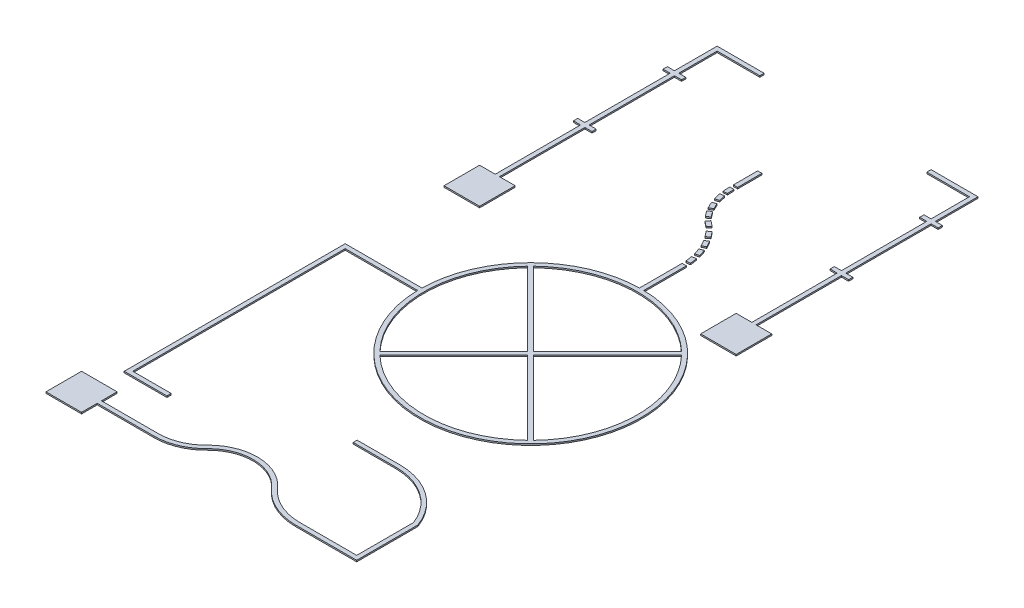
from build123d import *

# Parameters (mm, degrees)
SKETCH1_W           = 2438.4
SKETCH1_H           = 4876.8
BOSS_EXTRUDE1_DEPTH = 100
SKETCH2_W           = 2438.4
SKETCH2_H           = 4876.8
SKETCH2_W_2         = 29.994
SKETCH2_H_2         = 170.927857272
CUT_EXTRUDE1_DEPTH  = 100
CUT_EXTRUDE2_DEPTH  = 90
CUT_EXTRUDE3_DEPTH  = 90
CUT_EXTRUDE4_DEPTH  = 90
CUT_EXTRUDE5_DEPTH  = 90
CUT_EXTRUDE6_DEPTH  = 90
SKETCH8_W           = 29.994
SKETCH8_H           = 170.927857272
CUT_EXTRUDE7_DEPTH  = 90


with BuildPart() as part:
    # Sketch1 → Boss-Extrude1 (new body)
    with BuildSketch(Plane(origin=(0, 0, 0), x_dir=(1, 0, 0), z_dir=(0, 1, 0))):
        Rectangle(SKETCH1_W, SKETCH1_H)
    extrude(amount=BOSS_EXTRUDE1_DEPTH)

    # Sketch2 → Cut-Extrude1 (cut)
    # profile 1 of 5: a face of its own
    with BuildSketch(Plane(origin=(0, 100, 0), x_dir=(1, 0, 0), z_dir=(0, 1, 0))):
        Rectangle(SKETCH2_W, SKETCH2_H)
        with BuildLine():
            Line((-919.2, -2228.4), (-919.2, -2338.4))
            Line((-919.2, -2338.4), (-1169.2, -2338.4))
            Line((-1169.2, -2338.4), (-1169.2, -2088.4))
            Line((-1169.2, -2088.4), (-919.2, -2088.4))
            Line((-919.2, -2088.4), (-919.2, -2198.4))
            Line((-919.2, -2198.4), (-519.2, -2198.4))
            ThreePointArc((-519.2, -2198.4), (-388.263085664, -2171.917017743), (-277.909673512, -2096.631240126))
            ThreePointArc((-277.909673512, -2096.631240126), (-19.994263519, -1992.142953693), (231.567262992, -2111.117569023))
            ThreePointArc((231.567262992, -2111.117569023), (360.930329193, -2207.702777647), (518.697268509, -2241.953299987))
            Line((518.697268509, -2241.953299987), (918.697268509, -2241.953299987))
            Line((918.697268509, -2241.953299987), (918.697268509, -1841.953299987))
            ThreePointArc((918.697268509, -1841.953299987), (761.332604312, -1642.506806454), (518.697268509, -1567.203186754))
            Line((518.697268509, -1567.203186754), (218.697268509, -1567.203186754))
            Line((218.697268509, -1567.203186754), (218.697268509, -1539.074772669))
            Line((218.697268509, -1539.074772669), (518.697268509, -1539.074772669))
            ThreePointArc((518.697268509, -1539.074772669), (781.677972321, -1622.395299678), (948.697268509, -1841.953299987))
            Line((948.697268509, -1841.953299987), (948.697268509, -2271.953299987))
            Line((948.697268509, -2271.953299987), (518.697268509, -2271.953299987))
            ThreePointArc((518.697268509, -2271.953299987), (348.490866445, -2235.002223915), (208.9279, -2130.801553459))
            ThreePointArc((208.9279, -2130.801553459), (-20.846930763, -2022.130833888), (-256.425361631, -2117.569825155))
            ThreePointArc((-256.425361631, -2117.569825155), (-376.604559833, -2199.558992626), (-519.2, -2228.4))
            Line((-519.2, -2228.4), (-919.2, -2228.4))
        make_face(mode=Mode.SUBTRACT)
        with BuildLine():
            Line((-719.2, -1938.4), (-1019.2, -1938.4))
            Line((-1019.2, -1938.4), (-1019.2, -385))
            Line((-1019.2, -385), (-479.855755893, -385))
            ThreePointArc((-479.855755893, -385), (-251.543289326, 151.543289326), (285, 379.855755893))
            Line((285, 379.855755893), (285, 679.855755893))
            Line((285, 679.855755893), (315, 679.855755893))
            Line((315, 679.855755893), (315, 379.855755893))
            ThreePointArc((315, 379.855755893), (851.543289326, -951.543289326), (-479.855755893, -415))
            Line((-479.855755893, -415), (-989.2, -415))
            Line((-989.2, -415), (-989.2, -1908.4))
            Line((-989.2, -1908.4), (-719.2, -1908.4))
            Line((-719.2, -1908.4), (-719.2, -1938.4))
        make_face(mode=Mode.SUBTRACT)
        Polygon((-584.703, 2125.4), (-584.703, 2095.4), (-884.703, 2095.4), (-884.703, 1825.4), (-834.703, 1825.4), (-834.703, 1795.4), (-884.703, 1795.4), (-884.703, 1195.4), (-834.703, 1195.4), (-834.703, 1165.4), (-884.703, 1165.4), (-884.703, 565.4), (-774.703, 565.4), (-774.703, 315.4), (-1024.703, 315.4), (-1024.703, 565.4), (-914.703, 565.4), (-914.703, 1165.4), (-964.703, 1165.4), (-964.703, 1195.4), (-914.703, 1195.4), (-914.703, 1795.4), (-964.703, 1795.4), (-964.703, 1825.4), (-914.703, 1825.4), (-914.703, 2125.4), align=None, mode=Mode.SUBTRACT)
        with BuildLine():
            Line((313.363780337, 709.855755893), (283.48537458, 707.243266979))
            ThreePointArc((283.48537458, 707.243266979), (280.817354071, 730.454233152), (276.889903298, 753.485568645))
            Line((276.889903298, 753.485568645), (306.307291752, 759.330351401))
            ThreePointArc((306.307291752, 759.330351401), (310.509267678, 734.689146996), (313.363780337, 709.855755893))
        make_face(mode=Mode.SUBTRACT)
        with BuildLine():
            Line((299.292720231, 789.330351401), (270.333610539, 781.525596779))
            ThreePointArc((270.333610539, 781.525596779), (263.641859342, 803.91058617), (255.741601187, 825.898155504))
            Line((255.741601187, 825.898155504), (283.680743009, 836.804510677))
            ThreePointArc((283.680743009, 836.804510677), (292.133221855, 813.280030714), (299.292720231, 789.330351401))
        make_face(mode=Mode.SUBTRACT)
        with BuildLine():
            Line((270.72127371, 866.804510677), (243.628805062, 853.938183638))
            ThreePointArc((243.628805062, 853.938183638), (233.035185878, 874.762268653), (221.323804893, 894.978866774))
            Line((221.323804893, 894.978866774), (246.857174792, 910.713899361))
            ThreePointArc((246.857174792, 910.713899361), (259.387170406, 889.084179851), (270.72127371, 866.804510677))
        make_face(mode=Mode.SUBTRACT)
        with BuildLine():
            Line((165.011981963, 1009.40005714), (144.825754574, 987.217621459))
            ThreePointArc((144.825754574, 987.217621459), (127.124133149, 1002.466224119), (108.618763636, 1016.728712798))
            Line((108.618763636, 1016.728712798), (126.274156062, 1040.973946293))
            ThreePointArc((126.274156062, 1040.973946293), (146.073033678, 1025.714522931), (165.011981963, 1009.40005714))
        make_face(mode=Mode.SUBTRACT)
        with BuildLine():
            ThreePointArc((44.532414655, 1166.506238397), (53.763601741, 1145.241777983), (64.263689238, 1124.574406251))
            Line((64.263689238, 1124.574406251), (37.946077545, 1110.186100207))
            ThreePointArc((37.946077545, 1110.186100207), (26.624132388, 1132.471138247), (16.670406388, 1155.4))
            Line((16.670406388, 1155.4), (44.532414655, 1166.506238397))
        make_face(mode=Mode.SUBTRACT)
        with BuildLine():
            ThreePointArc((23.370750404, 1240.42684097), (28.170924763, 1217.747546054), (34.333657687, 1195.4))
            Line((34.333657687, 1195.4), (5.673377354, 1186.555319834))
            ThreePointArc((5.673377354, 1186.555319834), (-0.971721956, 1210.652041971), (-6.147613191, 1235.106479452))
            Line((-6.147613191, 1235.106479452), (23.370750404, 1240.42684097))
        make_face(mode=Mode.SUBTRACT)
        with BuildLine():
            ThreePointArc((77.22618432, 1102.631418758), (90.259847646, 1083.460719448), (104.428850873, 1065.113200834))
            Line((104.428850873, 1065.113200834), (81.255026867, 1046.0707767))
            ThreePointArc((81.255026867, 1046.0707767), (65.97699442, 1065.854383225), (51.923166638, 1086.525602039))
            Line((51.923166638, 1086.525602039), (77.22618432, 1102.631418758))
        make_face(mode=Mode.SUBTRACT)
        with BuildLine():
            Line((226.698240294, 940.713899361), (202.481901877, 923.018894908))
            ThreePointArc((202.481901877, 923.018894908), (188.18918005, 941.500923663), (172.911659512, 959.177593325))
            Line((172.911659512, 959.177593325), (195.061065513, 979.40005714))
            ThreePointArc((195.061065513, 979.40005714), (211.406470515, 960.487804723), (226.698240294, 940.713899361))
        make_face(mode=Mode.SUBTRACT)
        with BuildLine():
            Line((19.686621628, 1265.644853858), (-10.120104275, 1262.298344185))
            ThreePointArc((-10.120104275, 1262.298344185), (-12.156375106, 1287.211452455), (-12.682506858, 1312.202101666))
            Line((-12.682506858, 1312.202101666), (17.310223318, 1311.926107891))
            ThreePointArc((17.310223318, 1311.926107891), (17.798163275, 1288.749524745), (19.686621628, 1265.644853858))
        make_face(mode=Mode.SUBTRACT)
        with Locations((2.297, 1422.936071364)):
            Rectangle(SKETCH2_W_2, SKETCH2_H_2, mode=Mode.SUBTRACT)
        Polygon((779.297, 565.4), (889.297, 565.4), (889.297, 1165.4), (839.297, 1165.4), (839.297, 1195.4), (889.297, 1195.4), (889.297, 1795.4), (839.297, 1795.4), (839.297, 1825.4), (889.297, 1825.4), (889.297, 2095.4), (589.297, 2095.4), (589.297, 2125.4), (919.297, 2125.4), (919.297, 1825.4), (969.297, 1825.4), (969.297, 1795.4), (919.297, 1795.4), (919.297, 1195.4), (969.297, 1195.4), (969.297, 1165.4), (919.297, 1165.4), (919.297, 565.4), (1029.297, 565.4), (1029.297, 315.4), (779.297, 315.4), align=None, mode=Mode.SUBTRACT)
    # profile 2 of 5: a face of its own
    with BuildSketch(Plane(origin=(0, 100, 0), x_dir=(1, 0, 0), z_dir=(0, 1, 0))):
        with BuildLine():
            Line((-219.617948498, 140.830091247), (300.000000001, -378.787857251))
            Line((300.000000001, -378.787857251), (819.617948513, 140.830091233))
            ThreePointArc((819.617948513, 140.830091233), (300.00000001, 350), (-219.617948498, 140.830091247))
        make_face()
    # profile 3 of 5: a face of its own
    with BuildSketch(Plane(origin=(0, 100, 0), x_dir=(1, 0, 0), z_dir=(0, 1, 0))):
        with BuildLine():
            ThreePointArc((-240.830091247, 119.617948498), (-450, -399.99999999), (-240.830091262, -919.617948483))
            Line((-240.830091262, -919.617948483), (278.78785725, -400))
            Line((278.78785725, -400), (-240.830091247, 119.617948498))
        make_face()
    # profile 4 of 5: a face of its own
    with BuildSketch(Plane(origin=(0, 100, 0), x_dir=(1, 0, 0), z_dir=(0, 1, 0))):
        with BuildLine():
            Line((321.212142749, -399.999999999), (840.830091248, -919.617948498))
            ThreePointArc((840.830091248, -919.617948498), (1050, -399.999999989), (840.830091233, 119.617948514))
            Line((840.830091233, 119.617948514), (321.212142749, -399.999999999))
        make_face()
    # profile 5 of 5: a face of its own
    with BuildSketch(Plane(origin=(0, 100, 0), x_dir=(1, 0, 0), z_dir=(0, 1, 0))):
        with BuildLine():
            ThreePointArc((-219.617948483, -940.830091262), (300.00000001, -1150), (819.617948498, -940.830091248))
            Line((819.617948498, -940.830091248), (300, -421.21214275))
            Line((300, -421.21214275), (-219.617948483, -940.830091262))
        make_face()
    extrude(amount=-CUT_EXTRUDE1_DEPTH, mode=Mode.SUBTRACT)


with BuildPart() as cut_extrude1_piece_1:
    # of the separate pieces the step leaves, piece 1, a body of its own (cut_extrude1_pieces)
    add(part.part.solids().sort_by_distance((315, 0, -679.855755893))[0])

    # Sketch4 → Cut-Extrude3 (cut)
    with BuildSketch(Plane.XZ):
        with BuildLine():
            Line((285, -379.855755893), (285, -679.855755893))
            Line((285, -679.855755893), (315, -679.855755893))
            Line((315, -679.855755893), (315, -379.855755893))
            ThreePointArc((315, -379.855755893), (851.543289326, 951.543289326), (-479.855755893, 415))
            Line((-479.855755893, 415), (-989.2, 415))
            Line((-989.2, 415), (-989.2, 1908.4))
            Line((-989.2, 1908.4), (-719.2, 1908.4))
            Line((-719.2, 1908.4), (-719.2, 1938.4))
            Line((-719.2, 1938.4), (-1019.2, 1938.4))
            Line((-1019.2, 1938.4), (-1019.2, 385))
            Line((-1019.2, 385), (-479.855755893, 385))
            ThreePointArc((-479.855755893, 385), (-251.543289326, -151.543289326), (285, -379.855755893))
        make_face()
    extrude(amount=-CUT_EXTRUDE3_DEPTH, mode=Mode.SUBTRACT)


with BuildPart() as cut_extrude1_piece_2:
    # of the separate pieces the step leaves, piece 2, a body of its own (cut_extrude1_pieces)
    add(part.part.solids().sort_by_distance((218.697268509, 0, 1539.074772669))[0])

    # Sketch3 → Cut-Extrude2 (cut)
    with BuildSketch(Plane.XZ):
        with BuildLine():
            Line((948.697268509, 1841.953299987), (948.697268509, 2271.953299987))
            Line((948.697268509, 2271.953299987), (518.697268509, 2271.953299987))
            ThreePointArc((518.697268509, 2271.953299987), (348.490866445, 2235.002223915), (208.9279, 2130.801553459))
            ThreePointArc((208.9279, 2130.801553459), (-20.846930763, 2022.130833888), (-256.425361631, 2117.569825155))
            ThreePointArc((-256.425361631, 2117.569825155), (-376.604559833, 2199.558992626), (-519.2, 2228.4))
            Line((-519.2, 2228.4), (-919.2, 2228.4))
            Line((-919.2, 2228.4), (-919.2, 2338.4))
            Line((-919.2, 2338.4), (-1169.2, 2338.4))
            Line((-1169.2, 2338.4), (-1169.2, 2088.4))
            Line((-1169.2, 2088.4), (-919.2, 2088.4))
            Line((-919.2, 2088.4), (-919.2, 2198.4))
            Line((-919.2, 2198.4), (-519.2, 2198.4))
            ThreePointArc((-519.2, 2198.4), (-388.263085664, 2171.917017743), (-277.909673512, 2096.631240126))
            ThreePointArc((-277.909673512, 2096.631240126), (-19.994263519, 1992.142953693), (231.567262992, 2111.117569023))
            ThreePointArc((231.567262992, 2111.117569023), (360.930329193, 2207.702777647), (518.697268509, 2241.953299987))
            Line((518.697268509, 2241.953299987), (918.697268509, 2241.953299987))
            Line((918.697268509, 2241.953299987), (918.697268509, 1841.953299987))
            ThreePointArc((918.697268509, 1841.953299987), (761.332604312, 1642.506806454), (518.697268509, 1567.203186754))
            Line((518.697268509, 1567.203186754), (218.697268509, 1567.203186754))
            Line((218.697268509, 1567.203186754), (218.697268509, 1539.074772669))
            Line((218.697268509, 1539.074772669), (518.697268509, 1539.074772669))
            ThreePointArc((518.697268509, 1539.074772669), (781.677972321, 1622.395299678), (948.697268509, 1841.953299987))
        make_face()
    extrude(amount=-CUT_EXTRUDE2_DEPTH, mode=Mode.SUBTRACT)


with BuildPart() as cut_extrude1_piece_3:
    # of the separate pieces the step leaves, piece 3, a body of its own (cut_extrude1_pieces)
    add(part.part.solids().sort_by_distance((779.297, 0, -315.4))[0])

    # Sketch5 → Cut-Extrude4 (cut)
    with BuildSketch(Plane.XZ):
        Polygon((779.297, -565.4), (889.297, -565.4), (889.297, -1165.4), (839.297, -1165.4), (839.297, -1195.4), (889.297, -1195.4), (889.297, -1795.4), (839.297, -1795.4), (839.297, -1825.4), (889.297, -1825.4), (889.297, -2095.4), (589.297, -2095.4), (589.297, -2125.4), (919.297, -2125.4), (919.297, -1825.4), (969.297, -1825.4), (969.297, -1795.4), (919.297, -1795.4), (919.297, -1195.4), (969.297, -1195.4), (969.297, -1165.4), (919.297, -1165.4), (919.297, -565.4), (1029.297, -565.4), (1029.297, -315.4), (779.297, -315.4), align=None)
    extrude(amount=-CUT_EXTRUDE4_DEPTH, mode=Mode.SUBTRACT)


with BuildPart() as cut_extrude1_piece_4:
    # of the separate pieces the step leaves, piece 4, a body of its own (cut_extrude1_pieces)
    add(part.part.solids().sort_by_distance((-914.703, 0, -2125.4))[0])

    # Sketch6 → Cut-Extrude5 (cut)
    with BuildSketch(Plane.XZ):
        Polygon((-774.703, -315.4), (-1024.703, -315.4), (-1024.703, -565.4), (-914.703, -565.4), (-914.703, -1165.4), (-964.703, -1165.4), (-964.703, -1195.4), (-914.703, -1195.4), (-914.703, -1795.4), (-964.703, -1795.4), (-964.703, -1825.4), (-914.703, -1825.4), (-914.703, -2125.4), (-584.703, -2125.4), (-584.703, -2095.4), (-884.703, -2095.4), (-884.703, -1825.4), (-834.703, -1825.4), (-834.703, -1795.4), (-884.703, -1795.4), (-884.703, -1195.4), (-834.703, -1195.4), (-834.703, -1165.4), (-884.703, -1165.4), (-884.703, -565.4), (-774.703, -565.4), align=None)
    extrude(amount=-CUT_EXTRUDE5_DEPTH, mode=Mode.SUBTRACT)


with BuildPart() as cut_extrude1_piece_5:
    # of the separate pieces the step leaves, piece 5, a body of its own (cut_extrude1_pieces)
    add(part.part.solids().sort_by_distance((-12.7, 0, -1508.4))[0])


with BuildPart() as cut_extrude1_piece_6:
    # of the separate pieces the step leaves, piece 6, a body of its own (cut_extrude1_pieces)
    add(part.part.solids().sort_by_distance((202.481901877, 0, -923.018894908))[0])


with BuildPart() as cut_extrude1_piece_7:
    # of the separate pieces the step leaves, piece 7, a body of its own (cut_extrude1_pieces)
    add(part.part.solids().sort_by_distance((144.825754574, 0, -987.217621459))[0])


with BuildPart() as cut_extrude1_piece_8:
    # of the separate pieces the step leaves, piece 8, a body of its own (cut_extrude1_pieces)
    add(part.part.solids().sort_by_distance((283.680743009, 0, -836.804510677))[0])


with BuildPart() as cut_extrude1_piece_9:
    # of the separate pieces the step leaves, piece 9, a body of its own (cut_extrude1_pieces)
    add(part.part.solids().sort_by_distance((221.323804893, 0, -894.978866774))[0])


with BuildPart() as cut_extrude1_piece_10:
    # of the separate pieces the step leaves, piece 10, a body of its own (cut_extrude1_pieces)
    add(part.part.solids().sort_by_distance((276.889903298, 0, -753.485568645))[0])

    # Sketch7 → Cut-Extrude6 (cut)
    with BuildSketch(Plane.XZ):
        with BuildLine():
            Line((313.363780337, -709.855755893), (283.48537458, -707.243266979))
            ThreePointArc((283.48537458, -707.243266979), (280.817354071, -730.454233152), (276.889903298, -753.485568645))
            Line((276.889903298, -753.485568645), (306.307291752, -759.330351401))
            ThreePointArc((306.307291752, -759.330351401), (310.509267678, -734.689146996), (313.363780337, -709.855755893))
        make_face()
    extrude(amount=-CUT_EXTRUDE6_DEPTH, mode=Mode.SUBTRACT)


with BuildPart() as cut_extrude1_piece_11:
    # of the separate pieces the step leaves, piece 11, a body of its own (cut_extrude1_pieces)
    add(part.part.solids().sort_by_distance((64.263689238, 0, -1124.574406251))[0])


with BuildPart() as cut_extrude1_piece_12:
    # of the separate pieces the step leaves, piece 12, a body of its own (cut_extrude1_pieces)
    add(part.part.solids().sort_by_distance((23.370750404, 0, -1240.42684097))[0])


with BuildPart() as cut_extrude1_piece_13:
    # of the separate pieces the step leaves, piece 13, a body of its own (cut_extrude1_pieces)
    add(part.part.solids().sort_by_distance((-10.120104275, 0, -1262.298344185))[0])


with BuildPart() as cut_extrude1_piece_14:
    # of the separate pieces the step leaves, piece 14, a body of its own (cut_extrude1_pieces)
    add(part.part.solids().sort_by_distance((77.22618432, 0, -1102.631418758))[0])


with BuildPart() as cut_extrude7_tool:
    # Sketch8 → Cut-Extrude7 (new body)
    with BuildSketch(Plane.XZ):
        with BuildLine():
            Line((299.292720231, -789.330351401), (270.333610539, -781.525596779))
            ThreePointArc((270.333610539, -781.525596779), (263.641859342, -803.91058617), (255.741601187, -825.898155504))
            Line((255.741601187, -825.898155504), (283.680743009, -836.804510677))
            ThreePointArc((283.680743009, -836.804510677), (292.133221855, -813.280030714), (299.292720231, -789.330351401))
        make_face()
        with BuildLine():
            Line((270.72127371, -866.804510677), (243.628805062, -853.938183638))
            ThreePointArc((243.628805062, -853.938183638), (233.035185878, -874.762268653), (221.323804893, -894.978866774))
            Line((221.323804893, -894.978866774), (246.857174792, -910.713899361))
            ThreePointArc((246.857174792, -910.713899361), (259.387170406, -889.084179851), (270.72127371, -866.804510677))
        make_face()
        with BuildLine():
            Line((226.698240294, -940.713899361), (202.481901877, -923.018894908))
            ThreePointArc((202.481901877, -923.018894908), (188.18918005, -941.500923663), (172.911659512, -959.177593325))
            Line((172.911659512, -959.177593325), (195.061065513, -979.40005714))
            ThreePointArc((195.061065513, -979.40005714), (211.406470515, -960.487804723), (226.698240294, -940.713899361))
        make_face()
        with BuildLine():
            Line((165.011981963, -1009.40005714), (144.825754574, -987.217621459))
            ThreePointArc((144.825754574, -987.217621459), (127.124133149, -1002.466224119), (108.618763636, -1016.728712798))
            Line((108.618763636, -1016.728712798), (126.274156062, -1040.973946293))
            ThreePointArc((126.274156062, -1040.973946293), (146.073033678, -1025.714522931), (165.011981963, -1009.40005714))
        make_face()
        with BuildLine():
            Line((51.923166638, -1086.525602039), (77.22618432, -1102.631418758))
            ThreePointArc((77.22618432, -1102.631418758), (90.259847646, -1083.460719448), (104.428850873, -1065.113200834))
            Line((104.428850873, -1065.113200834), (81.255026867, -1046.0707767))
            ThreePointArc((81.255026867, -1046.0707767), (65.97699442, -1065.854383225), (51.923166638, -1086.525602039))
        make_face()
        with BuildLine():
            Line((16.670406388, -1155.4), (44.532414655, -1166.506238397))
            ThreePointArc((44.532414655, -1166.506238397), (53.763601741, -1145.241777983), (64.263689238, -1124.574406251))
            Line((64.263689238, -1124.574406251), (37.946077545, -1110.186100207))
            ThreePointArc((37.946077545, -1110.186100207), (26.624132388, -1132.471138247), (16.670406388, -1155.4))
        make_face()
        with BuildLine():
            Line((-6.147613191, -1235.106479452), (23.370750404, -1240.42684097))
            ThreePointArc((23.370750404, -1240.42684097), (28.170924763, -1217.747546054), (34.333657687, -1195.4))
            Line((34.333657687, -1195.4), (5.673377354, -1186.555319834))
            ThreePointArc((5.673377354, -1186.555319834), (-0.971721956, -1210.652041971), (-6.147613191, -1235.106479452))
        make_face()
        with BuildLine():
            Line((-12.682506858, -1312.202101666), (17.310223318, -1311.926107891))
            ThreePointArc((17.310223318, -1311.926107891), (17.798163275, -1288.749524745), (19.686621628, -1265.644853858))
            Line((19.686621628, -1265.644853858), (-10.120104275, -1262.298344185))
            ThreePointArc((-10.120104275, -1262.298344185), (-12.156375106, -1287.211452455), (-12.682506858, -1312.202101666))
        make_face()
        with Locations((2.297, -1422.936071364)):
            Rectangle(SKETCH8_W, SKETCH8_H)
    extrude(amount=-CUT_EXTRUDE7_DEPTH)


with BuildPart() as cut_extrude1_piece_5_1:
    add(cut_extrude1_piece_5.part)

    # Cut-Extrude7: cut by cut_extrude7_tool
    add(cut_extrude7_tool.part, mode=Mode.SUBTRACT)


with BuildPart() as cut_extrude1_piece_6_1:
    add(cut_extrude1_piece_6.part)

    # Cut-Extrude7: cut by cut_extrude7_tool
    add(cut_extrude7_tool.part, mode=Mode.SUBTRACT)


with BuildPart() as cut_extrude1_piece_7_1:
    add(cut_extrude1_piece_7.part)

    # Cut-Extrude7: cut by cut_extrude7_tool
    add(cut_extrude7_tool.part, mode=Mode.SUBTRACT)


with BuildPart() as cut_extrude1_piece_8_1:
    add(cut_extrude1_piece_8.part)

    # Cut-Extrude7: cut by cut_extrude7_tool
    add(cut_extrude7_tool.part, mode=Mode.SUBTRACT)


with BuildPart() as cut_extrude1_piece_9_1:
    add(cut_extrude1_piece_9.part)

    # Cut-Extrude7: cut by cut_extrude7_tool
    add(cut_extrude7_tool.part, mode=Mode.SUBTRACT)


with BuildPart() as cut_extrude1_piece_11_1:
    add(cut_extrude1_piece_11.part)

    # Cut-Extrude7: cut by cut_extrude7_tool
    add(cut_extrude7_tool.part, mode=Mode.SUBTRACT)


with BuildPart() as cut_extrude1_piece_12_1:
    add(cut_extrude1_piece_12.part)

    # Cut-Extrude7: cut by cut_extrude7_tool
    add(cut_extrude7_tool.part, mode=Mode.SUBTRACT)


with BuildPart() as cut_extrude1_piece_13_1:
    add(cut_extrude1_piece_13.part)

    # Cut-Extrude7: cut by cut_extrude7_tool
    add(cut_extrude7_tool.part, mode=Mode.SUBTRACT)


with BuildPart() as cut_extrude1_piece_14_1:
    add(cut_extrude1_piece_14.part)

    # Cut-Extrude7: cut by cut_extrude7_tool
    add(cut_extrude7_tool.part, mode=Mode.SUBTRACT)


solid = Compound([cut_extrude1_piece_1.part, cut_extrude1_piece_2.part, cut_extrude1_piece_3.part, cut_extrude1_piece_4.part, cut_extrude1_piece_10.part, cut_extrude1_piece_5_1.part, cut_extrude1_piece_6_1.part, cut_extrude1_piece_7_1.part, cut_extrude1_piece_8_1.part, cut_extrude1_piece_9_1.part, cut_extrude1_piece_11_1.part, cut_extrude1_piece_12_1.part, cut_extrude1_piece_13_1.part, cut_extrude1_piece_14_1.part])
